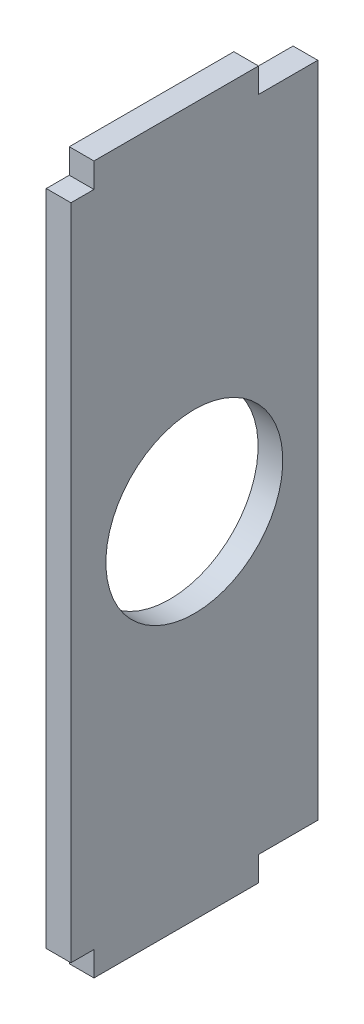
from build123d import *

# Parameters (mm, degrees)
ESQUISSE1_R        = 10.75
BOSS_EXTRU_1_DEPTH = 3


with BuildPart() as part:
    # Esquisse1 → Boss.-Extru.1 (new body)
    with BuildSketch(Plane(origin=(-3, 0, 0), x_dir=(0, -1, 0), z_dir=(-1, 0, 0))):
        Polygon((40, 15), (-40, 15), (-40, 12.2), (-43, 12.2), (-43, -7.8), (-40, -7.8), (-40, -15), (40, -15), (40, -7.8), (43, -7.8), (43, 12.2), (40, 12.2), align=None)
        with Locations(Location((0, 0, 0), (0, 0, 180))):
            Circle(ESQUISSE1_R, mode=Mode.SUBTRACT)
    extrude(amount=-BOSS_EXTRU_1_DEPTH)


solid = part.part
